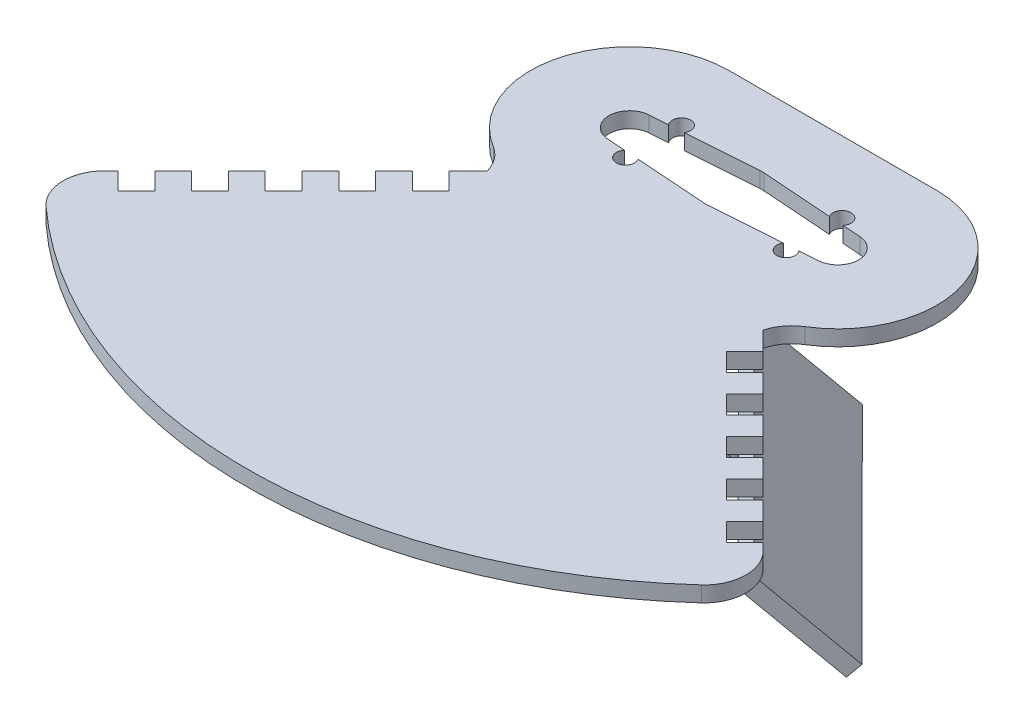
from build123d import *

# Parameters (mm, degrees)
SKETCH_1_W          = 180
SKETCH_1_H          = 123.475609756
EXTRUDE_1_DEPTH     = 3
SKETCH_2_OUTSIDE_W  = 225.66
SKETCH_2_OUTSIDE_H  = 169.136
CUT_EXTRUDE_1_DEPTH = 10
EXTRUDE_3_DEPTH     = 1.5
EXTRUDE_4_DEPTH     = 3
CUT_EXTRUDE_2_DEPTH = 13
EXTRUDE_5_DEPTH     = 3
CUT_EXTRUDE_4_DEPTH = 5


with BuildPart() as part:
    # 草图1 → 凸台-拉伸1 (new body)
    with BuildSketch(Plane(origin=(0, 0, 0), x_dir=(1, 0, 0), z_dir=(0, 1, 0))):
        Rectangle(SKETCH_1_W, SKETCH_1_H)
    extrude(amount=EXTRUDE_1_DEPTH)

    # 草图2 outside → 切除-拉伸1 (cut)
    with BuildSketch(Plane(origin=(0, 3, 0), x_dir=(1, 0, 0), z_dir=(0, 1, 0))):
        Rectangle(SKETCH_2_OUTSIDE_W, SKETCH_2_OUTSIDE_H)
        with BuildLine():
            Line((63.393156076, -4.57196386), (17.660793085, 41.160399131))
            ThreePointArc((17.660793085, 41.160399131), (13.212332654, 43.192679399), (8.519172912, 41.81673793))
            ThreePointArc((8.519172912, 41.81673793), (0.135427504, 39.028910463), (-8.248317905, 41.81673793))
            ThreePointArc((-8.248317905, 41.81673793), (-12.941477647, 43.192679399), (-17.389938078, 41.160399131))
            Line((-17.389938078, 41.160399131), (-63.122301068, -4.57196386))
            ThreePointArc((-63.122301068, -4.57196386), (-65.463259353, -10.415886745), (-62.851632161, -16.14396878))
            ThreePointArc((-62.851632161, -16.14396878), (0.135427504, -40.524587109), (63.122487168, -16.14396878))
            ThreePointArc((63.122487168, -16.14396878), (65.73411436, -10.415886745), (63.393156076, -4.57196386))
        make_face(mode=Mode.SUBTRACT)
    extrude(amount=-CUT_EXTRUDE_1_DEPTH, mode=Mode.SUBTRACT)

    # 草图4 → 凸台-拉伸3 (add, symmetric)
    with BuildSketch(Plane(origin=(11.169764148, 15.796431947, -11.169764148), x_dir=(-0.8660254037844386, 0.40824829046386313, -0.288675134594813), z_dir=(-0.5000000000000001, -0.7071067811865476, 0.49999999999999983))):
        Polygon((-42.887555568, 35.134950382), (-23.8863598, 8.357630936), (-25.587706579, 7.150354633), (-44.588902348, 33.927674079), align=None)
    extrude_3 = extrude(amount=EXTRUDE_3_DEPTH, both=True)

    # 草图5 → 凸台-拉伸4 (add)
    with BuildSketch(Plane(origin=(11.919764148, 16.857092119, -11.919764148), x_dir=(0.8660254037844387, -0.408248290463863, 0.2886751345948128), z_dir=(0.49999999999999994, 0.7071067811865477, -0.4999999999999999))):
        Polygon((5.305528324, 33.262652537), (23.440849678, 58.85571886), (73.424034658, 23.437488372), (55.288713303, -2.155577951), align=None)
    extrude_4 = extrude(amount=EXTRUDE_4_DEPTH)

    # 草图6 → 切除-拉伸2 (cut)
    with BuildSketch(Plane(origin=(13.419764148, 18.978412462, -13.419764148), x_dir=(0.8660254037844387, -0.40824829046386313, 0.2886751345948128), z_dir=(0.5, 0.7071067811865477, -0.49999999999999983))):
        Polygon((17.332913893, 50.236031202), (67.316098873, 14.817800715), (73.424034658, 23.437488372), (23.440849678, 58.85571886), align=None)
    cut_extrude_2 = extrude(amount=-CUT_EXTRUDE_2_DEPTH, mode=Mode.SUBTRACT)

    # 镜向2: 凸台-拉伸3, 凸台-拉伸4, 切除-拉伸2 across plane
    add(extrude_3.mirror(Plane(origin=(0, 0, 0), x_dir=(0, 0, 1), z_dir=(1, 0, 0))))
    add(extrude_4.mirror(Plane(origin=(0, 0, 0), x_dir=(0, 0, 1), z_dir=(1, 0, 0))))
    add(cut_extrude_2.mirror(Plane(origin=(0, 0, 0), x_dir=(0, 0, 1), z_dir=(1, 0, 0))), mode=Mode.SUBTRACT)

    # 草图7 → 凸台-拉伸5 (add)
    with BuildSketch(Plane(origin=(0, 3, 0), x_dir=(1, 0, 0), z_dir=(0, 1, 0))):
        with BuildLine():
            Line((-19.864572496, 72.089252639), (20.135427504, 72.089252639))
            ThreePointArc((20.135427504, 72.089252639), (38.479418015, 58.205265935), (30.099048805, 36.780129142))
            ThreePointArc((30.099048805, 36.780129142), (26.400179556, 30.999210524), (28.649163581, 24.515174385))
            Line((28.649163581, 24.515174385), (-28.378308574, 24.515174385))
            ThreePointArc((-28.378308574, 24.515174385), (-26.129324549, 30.999210524), (-29.828193798, 36.780129142))
            ThreePointArc((-29.828193798, 36.780129142), (-38.208563008, 58.205265935), (-19.864572496, 72.089252639))
        make_face()
        with BuildLine():
            Line((20.415427504, 57.019098429), (16.875331791, 57.267514495))
            ThreePointArc((16.875331791, 57.267514495), (15.677130379, 60.161371451), (14.08652518, 57.463211003))
            Line((14.08652518, 57.463211003), (0.513427504, 58.415664216))
            ThreePointArc((0.513427504, 58.415664216), (0.135427504, 58.428910463), (-0.242572496, 58.415664216))
            Line((-0.242572496, 58.415664216), (-13.815670173, 57.463211003))
            ThreePointArc((-13.815670173, 57.463211003), (-15.406275372, 60.161371451), (-16.604476783, 57.267514495))
            Line((-16.604476783, 57.267514495), (-20.144572496, 57.019098429))
            ThreePointArc((-20.144572496, 57.019098429), (-23.864572496, 53.028910463), (-20.144572496, 49.038722498))
            Line((-20.144572496, 49.038722498), (-16.604476783, 48.790306431))
            ThreePointArc((-16.604476783, 48.790306431), (-15.406275372, 45.896449475), (-13.815670173, 48.594609923))
            Line((-13.815670173, 48.594609923), (-0.242572496, 47.64215671))
            ThreePointArc((-0.242572496, 47.64215671), (0.135427504, 47.628910463), (0.513427504, 47.64215671))
            Line((0.513427504, 47.64215671), (14.08652518, 48.594609923))
            ThreePointArc((14.08652518, 48.594609923), (15.677130379, 45.896449475), (16.875331791, 48.790306431))
            Line((16.875331791, 48.790306431), (20.415427504, 49.038722498))
            ThreePointArc((20.415427504, 49.038722498), (24.135427504, 53.028910463), (20.415427504, 57.019098429))
        make_face(mode=Mode.SUBTRACT)
    extrude(amount=-EXTRUDE_5_DEPTH)

    # 草图8 → 切除-拉伸4 (cut)
    with BuildSketch(Plane(origin=(0, 3, 0), x_dir=(1, 0, 0), z_dir=(0, 1, 0))):
        Polygon((54.918650137, -3.168525733), (58.454184043, -6.704059639), (61.989717949, -3.168525733), (58.454184043, 0.367008173), align=None)
        Polygon((51.383116231, 7.438075985), (47.847582325, 3.902542079), (51.383116231, 0.367008173), (54.918650137, 3.902542079), align=None)
        Polygon((44.31204842, 14.509143797), (40.776514514, 10.973609891), (44.31204842, 7.438075985), (47.847582325, 10.973609891), align=None)
        Polygon((37.240980608, 21.580211608), (33.705446702, 18.044677703), (37.240980608, 14.509143797), (40.776514514, 18.044677703), align=None)
        Polygon((30.169912796, 28.65127942), (26.63437889, 25.115745514), (30.169912796, 21.580211608), (33.705446702, 25.115745514), align=None)
        Polygon((-33.705446702, 25.115745514), (-30.169912796, 28.65127942), (-26.63437889, 25.115745514), (-30.169912796, 21.580211608), align=None)
        Polygon((-40.776514514, 18.044677703), (-37.240980608, 21.580211608), (-33.705446702, 18.044677703), (-37.240980608, 14.509143797), align=None)
        Polygon((-47.847582325, 10.973609891), (-44.31204842, 14.509143797), (-40.776514514, 10.973609891), (-44.31204842, 7.438075985), align=None)
        Polygon((-54.918650137, 3.902542079), (-51.383116231, 7.438075985), (-47.847582325, 3.902542079), (-51.383116231, 0.367008173), align=None)
        Polygon((-58.454184043, 0.367008173), (-54.918650137, -3.168525733), (-58.454184043, -6.704059639), (-61.989717949, -3.168525733), align=None)
    extrude(amount=-CUT_EXTRUDE_4_DEPTH, mode=Mode.SUBTRACT)


solid = part.part
